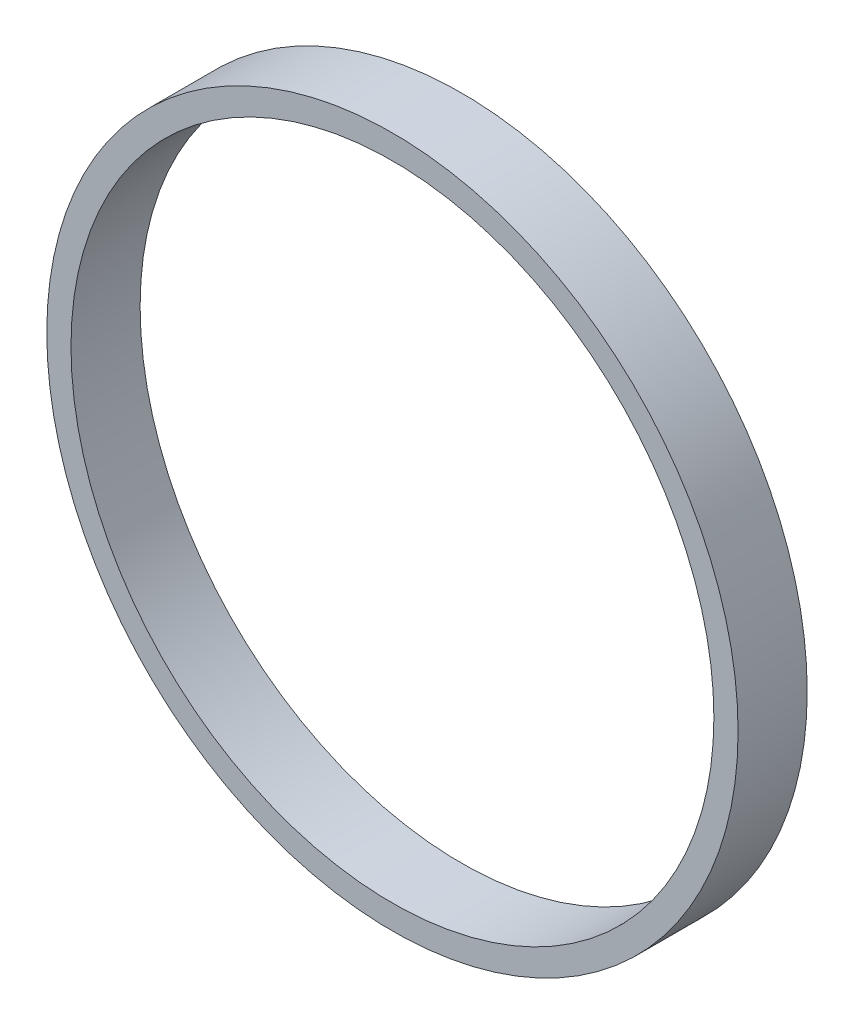
from build123d import *

# Parameters (mm, degrees)
SKETCH_1_R      = 20
SKETCH_1_R_2    = 18.6
EXTRUDE_1_DEPTH = 4


with BuildPart() as part:
    # 草图1 → 凸台-拉伸1 (new body)
    with BuildSketch(Plane.XY):
        Circle(SKETCH_1_R)
        Circle(SKETCH_1_R_2, mode=Mode.SUBTRACT)
    extrude(amount=EXTRUDE_1_DEPTH)


solid = part.part
